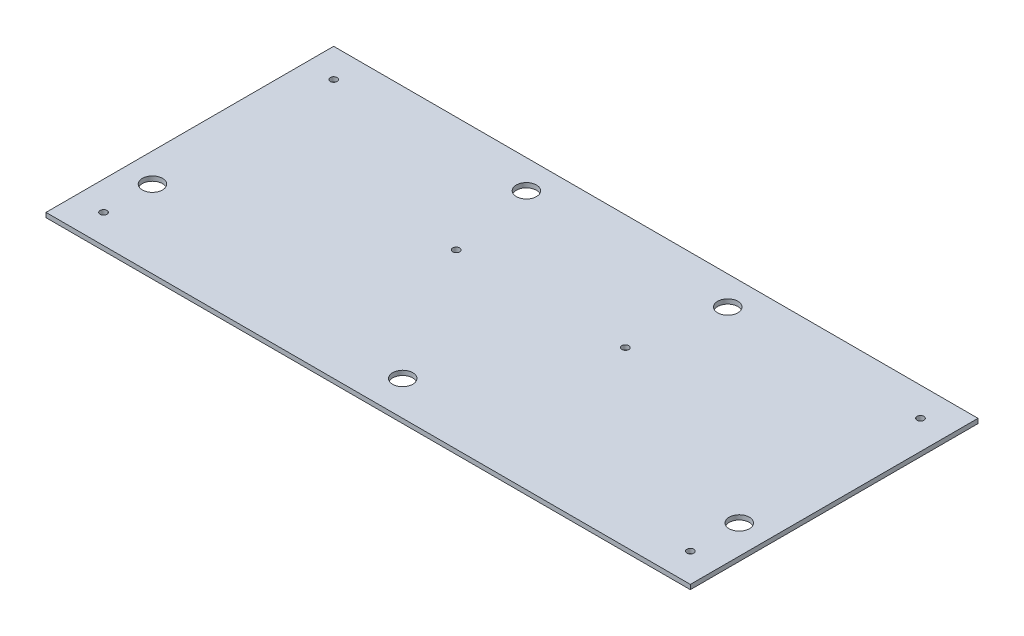
from build123d import *

# Parameters (mm, degrees)
SKETCH1_W            = 224
SKETCH1_H            = 100
BOSS_EXTRUDE1_DEPTH  = 1.6
M2_CLEARANCE_HOLE1_D = 2.4
MIRROR2_COPY_1_D     = 2.4
SKETCH5_R            = 3.5
CUT_EXTRUDE2_DEPTH   = 123.664420269
M2_CLEARANCE_HOLE2_D = 2.4
SKETCH12_R           = 3.5
CUT_EXTRUDE3_DEPTH   = 2


with BuildPart() as part:
    # Sketch1 → Boss-Extrude1 (new body)
    with BuildSketch(Plane(origin=(0, 0, 0), x_dir=(1, 0, 0), z_dir=(0, 1, 0))):
        Rectangle(SKETCH1_W, SKETCH1_H)
    extrude(amount=BOSS_EXTRUDE1_DEPTH)

    # M2 Clearance Hole1 (through all)
    with Locations(Plane.XZ):
        with Locations((-102, -40)):
            m2_clearance_hole1 = Hole(M2_CLEARANCE_HOLE1_D / 2)

    # Mirror1: M2 Clearance Hole1 across plane
    add(m2_clearance_hole1.mirror(Plane(origin=(0, 0, 0), x_dir=(0, 0, 1), z_dir=(1, 0, 0))), mode=Mode.SUBTRACT)

    # Mirror2: M2 Clearance Hole1 across plane
    add(m2_clearance_hole1.mirror(Plane.XY), mode=Mode.SUBTRACT)

    # Mirror2 copy 1 (through all)
    with Locations(Plane(origin=(0, 0, 0), x_dir=(-1, 0, 0), z_dir=(0, -1, 0))):
        with Locations((-102, -40)):
            Hole(MIRROR2_COPY_1_D / 2)

    # Sketch5 → Cut-Extrude2 (cut, through all)
    with BuildSketch(Plane(origin=(0, 0, 0), x_dir=(1, 0, 0), z_dir=(0, 1, 0))):
        with Locations(Location((-35, 40, 0), (0, 0, 270))):
            Circle(SKETCH5_R)
        with Locations(Location((35, 40, 0), (0, 0, 270))):
            Circle(SKETCH5_R)
        with Locations(Location((0, -38, 0), (0, 0, 270))):
            Circle(SKETCH5_R)
    extrude(amount=CUT_EXTRUDE2_DEPTH, mode=Mode.SUBTRACT)

    # M2 Clearance Hole2 (through all)
    with Locations(Plane.XZ):
        with Locations((-102, 23), (-29.412991036, -10), (29.412991036, -10), (102, 23)):
            Hole(M2_CLEARANCE_HOLE2_D / 2)

    # Sketch12 → Cut-Extrude3 (cut)
    with BuildSketch(Plane(origin=(0, 0, 0), x_dir=(1, 0, 0), z_dir=(0, 1, 0))):
        with Locations(Location((-102, -23, 0), (0, 0, 270))):
            Circle(SKETCH12_R)
        with Locations(Location((102, -23, 0), (0, 0, 270))):
            Circle(SKETCH12_R)
    extrude(amount=CUT_EXTRUDE3_DEPTH, mode=Mode.SUBTRACT)


solid = part.part
